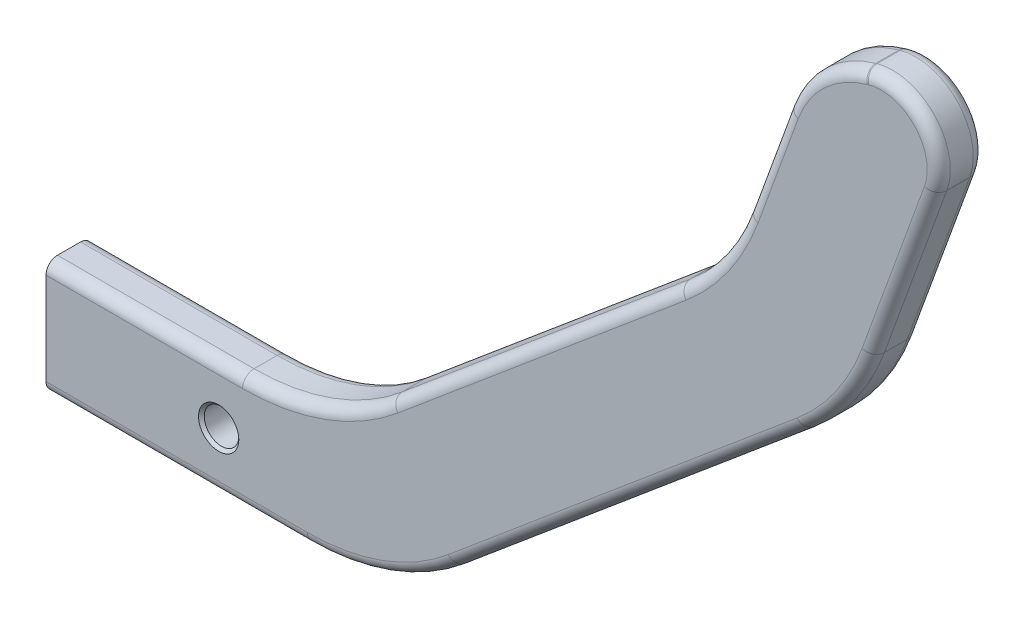
from build123d import *

# Parameters (mm, degrees)
SCHIZZO1_R                   = 1.5
ESTRUSIONE_ESTRUSIONE1_DEPTH = 4
SMUSSO1_SIZE                 = 0.25
RACCORDO4_R                  = 1
RACCORDO5_R                  = 1


with BuildPart() as part:
    # Schizzo1 → Estrusione-Estrusione1 (new body)
    with BuildSketch(Plane.XY):
        with BuildLine():
            Line((0, 0), (22.720595315, 0))
            ThreePointArc((22.720595315, 0), (29.560998181, 1.206147584), (35.576347508, 4.679111138))
            Line((35.576347508, 4.679111138), (65.894780202, 30.119296829))
            ThreePointArc((65.894780202, 30.119296829), (69.422068894, 33.968656964), (71.832880424, 38.599782825))
            Line((71.832880424, 38.599782825), (77.25204587, 53.48881752))
            ThreePointArc((77.25204587, 53.48881752), (76.217545127, 58.601179223), (71.195710383, 60.011005371))
            Line((71.195710383, 60.011005371), (71.083987609, 59.979479494))
            ThreePointArc((71.083987609, 59.979479494), (66.995210403, 57.683229946), (64.402806168, 53.775506658))
            Line((64.402806168, 53.775506658), (60.906270246, 44.168853168))
            ThreePointArc((60.906270246, 44.168853168), (58.495458716, 39.537727307), (54.968170024, 35.688367172))
            Line((54.968170024, 35.688367172), (29.930313668, 14.679111138))
            ThreePointArc((29.930313668, 14.679111138), (23.91496434, 11.206147584), (17.074561474, 10))
            Line((17.074561474, 10), (0, 10))
            Line((0, 10), (0, 0))
        make_face()
        with Locations((15, 5)):
            Circle(SCHIZZO1_R, mode=Mode.SUBTRACT)
    extrude(amount=-ESTRUSIONE_ESTRUSIONE1_DEPTH)

    # Smusso1
    smusso1_edges = [part.edges().sort_by_distance(p)[0] for p in [
        (13.5, 5, 0),
        (13.5, 5, -4),
    ]]
    chamfer(smusso1_edges, length=SMUSSO1_SIZE)

    # Raccordo4
    raccordo4_edges = [part.edges().sort_by_distance(p)[0] for p in [
        (74.542463147, 46.044300172, -4),
        (76.217545127, 58.601179223, -4),
        (71.139848996, 59.995242433, -4),
        (66.995210403, 57.683229946, -4),
        (62.654538207, 48.972179913, -4),
        (58.495458716, 39.537727307, -4),
        (42.449241846, 25.183739155, -4),
        (23.91496434, 11.206147584, -4),
        (8.537280737, 10, -4),
        (11.360297657, 0, -4),
        (29.560998181, 1.206147584, -4),
        (50.735563855, 17.399203983, -4),
        (69.422068894, 33.968656964, -4),
    ]]
    fillet(raccordo4_edges, radius=RACCORDO4_R)

    # Raccordo5
    raccordo5_edges = [part.edges().sort_by_distance(p)[0] for p in [
        (69.422068894, 33.968656964, 0),
        (50.735563855, 17.399203983, 0),
        (29.560998181, 1.206147584, 0),
        (11.360297657, 0, 0),
        (8.537280737, 10, 0),
        (23.91496434, 11.206147584, 0),
        (42.449241846, 25.183739155, 0),
        (58.495458716, 39.537727307, 0),
        (62.654538207, 48.972179913, 0),
        (66.995210403, 57.683229946, 0),
        (71.139848996, 59.995242433, 0),
        (76.217545127, 58.601179223, 0),
        (74.542463147, 46.044300172, 0),
    ]]
    fillet(raccordo5_edges, radius=RACCORDO5_R)


solid = part.part
